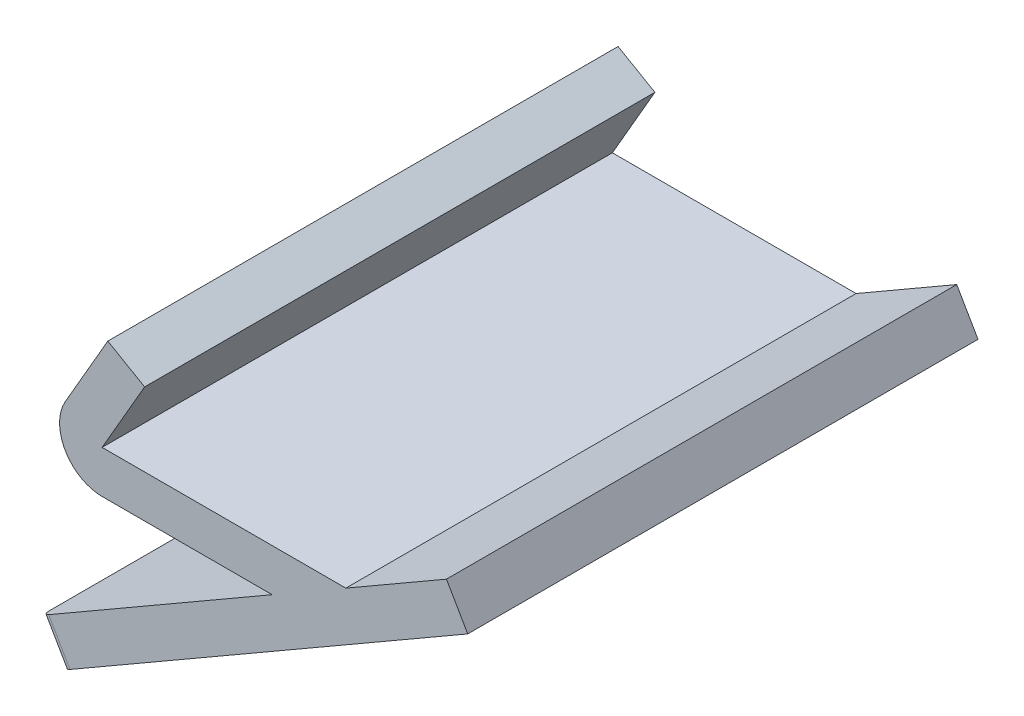
from build123d import *

# Parameters (mm, degrees)
SKETCH_1_W                          = 30
SKETCH_1_H                          = 5
EXTRUDE_1_DEPTH                     = 60
EXTRUDE_2_DEPTH                     = 60
EXTRUDE_3_DEPTH                     = 60
EXTRUDE_4_DEPTH                     = 60
HOLE_WIZARD_1_D                     = 3.4
HOLE_WIZARD_1_CBORE_D               = 6
HOLE_WIZARD_1_CBORE_DEPTH           = 3.4
HOLE_WIZARD_1_ON_FACE_2_D           = 3.4
HOLE_WIZARD_1_ON_FACE_2_CBORE_D     = 6
HOLE_WIZARD_1_ON_FACE_2_CBORE_DEPTH = 3.4
CUT_EXTRUDE_1_DEPTH                 = 60
CUT_EXTRUDE_2_DEPTH                 = 60


with BuildPart() as part:
    # 草图1 → 凸台-拉伸1 (new body)
    with BuildSketch(Plane.XY):
        with Locations((-4.245283019, 8.79713097)):
            Rectangle(SKETCH_1_W, SKETCH_1_H)
    extrude(amount=EXTRUDE_1_DEPTH)



with BuildPart() as body_2:
    # 草图2 → 凸台-拉伸2 (new body)
    with BuildSketch(Plane.XY.offset(60)):
        Polygon((-19.245283019, 11.29713097), (-14.245283019, 19.957385008), (-18.575410038, 22.457385008), (-23.575410038, 13.79713097), align=None)
    extrude(amount=-EXTRUDE_2_DEPTH)


with BuildPart() as part_1:
    add(part.part)

    add(body_2.part)  # 凸台-拉伸3 merges body 2
    # 草图3 → 凸台-拉伸3 (add)
    with BuildSketch(Plane.XY.offset(60)):
        with BuildLine():
            Line((-23.575410038, 13.79713097), (-19.245283019, 11.29713097))
            Line((-19.245283019, 11.29713097), (-19.245283019, 6.29713097))
            ThreePointArc((-19.245283019, 6.29713097), (-23.575410038, 8.79713097), (-23.575410038, 13.79713097))
        make_face()
    extrude(amount=-EXTRUDE_3_DEPTH)

    # 草图4 → 凸台-拉伸4 (add)
    with BuildSketch(Plane.XY.offset(60)):
        Polygon((10.754716981, 6.29713097), (-23.88629917, -13.70286903), (-26.38629917, -9.372742011), (8.254716981, 10.627257989), (21.245098038, 18.127257989), (23.745098038, 13.79713097), align=None)
    extrude(amount=-EXTRUDE_4_DEPTH)

    # 打孔尺寸(%根据)内六角圆柱头螺钉的类型1 (through all)
    with Locations(Plane(origin=(-21.157984096, -6.354172895, 26.500098518), x_dir=(0.866025403784, 0.5, 0), z_dir=(-0.5, 0.866025403784, 0))):
        with Locations((0, 0)):
            CounterBoreHole(HOLE_WIZARD_1_D / 2, HOLE_WIZARD_1_CBORE_D / 2, HOLE_WIZARD_1_CBORE_DEPTH)

    # 打孔尺寸(%根据)内六角圆柱头螺钉的类型1 on face 2 (through all)
    with Locations(Plane(origin=(-21.190146748, -6.372742011, 33.5), x_dir=(0.866025302838, 0.500000174844, 0), z_dir=(-0.500000174844, 0.866025302838, 0))):
        with Locations((0, 0)):
            CounterBoreHole(HOLE_WIZARD_1_ON_FACE_2_D / 2, HOLE_WIZARD_1_ON_FACE_2_CBORE_D / 2, HOLE_WIZARD_1_ON_FACE_2_CBORE_DEPTH)

    # 草图7 → 切除-拉伸1 (cut)
    with BuildSketch(Plane(origin=(-2.53805845, 4.396046189, 0), x_dir=(0.8660254037844416, 0.499999999999995, 0), z_dir=(-0.499999999999995, 0.8660254037844416, 0))):
        with BuildLine():
            Line((-26.537576399, 0), (-27.537576399, 0))
            Line((-27.537576399, 0), (-27.537576399, -1))
            ThreePointArc((-27.537576399, -1), (-27.24468318, -0.292893219), (-26.537576399, 0))
        make_face()
    extrude(amount=-CUT_EXTRUDE_1_DEPTH, mode=Mode.SUBTRACT)

    # 草图9 → 切除-拉伸2 (cut)
    with BuildSketch(Plane(origin=(-2.53805845, 4.396046189, 0), x_dir=(0.8660254037844416, 0.499999999999995, 0), z_dir=(-0.499999999999995, 0.8660254037844416, 0))):
        with BuildLine():
            Line((-27.537576399, -59), (-27.537576399, -60))
            Line((-27.537576399, -60), (-26.537576399, -60))
            ThreePointArc((-26.537576399, -60), (-27.24468318, -59.707106781), (-27.537576399, -59))
        make_face()
    extrude(amount=-CUT_EXTRUDE_2_DEPTH, mode=Mode.SUBTRACT)


solid = part_1.part
